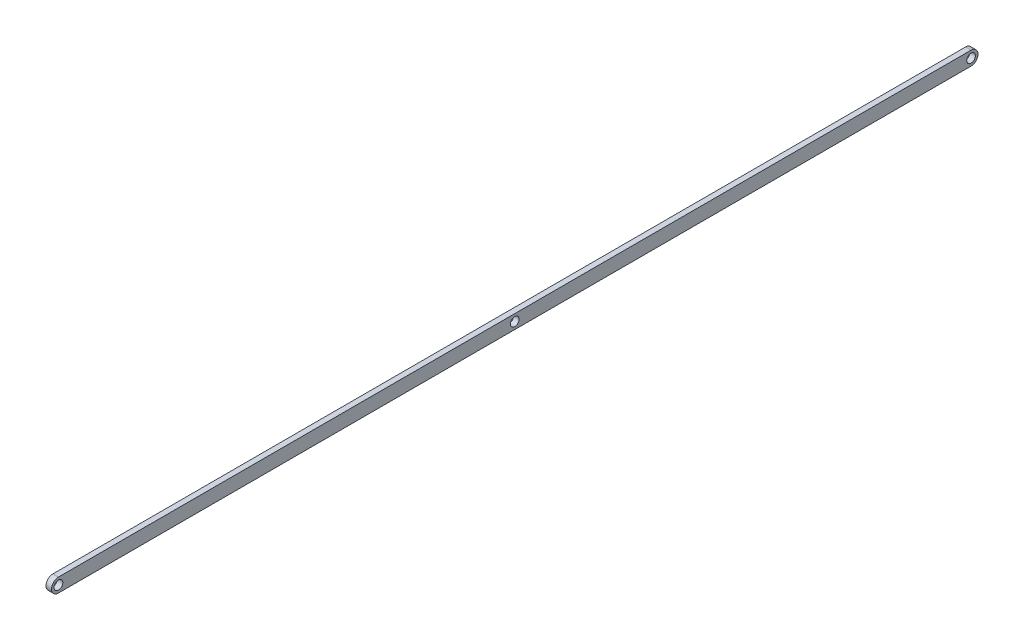
from build123d import *

# Parameters (mm, degrees)
BOSS_EXTRUDE1_DEPTH   = 5.08
F_8_0MM_DOWEL_HOLE1_D = 8


with BuildPart() as part:
    # Sketch1 → Boss-Extrude1 (new body)
    with BuildSketch(Plane(origin=(0, 0, 0), x_dir=(0, 0, -1), z_dir=(1, 0, 0))):
        with BuildLine():
            Line((0, 6.35), (838.2, 6.35))
            ThreePointArc((838.2, 6.35), (844.55, 0), (838.2, -6.35))
            Line((838.2, -6.35), (0, -6.35))
            ThreePointArc((0, -6.35), (-6.35, 0), (0, 6.35))
        make_face()
    extrude(amount=BOSS_EXTRUDE1_DEPTH)

    # Ø8.0mm Dowel Hole1 (through all)
    with Locations(Plane(origin=(5.08, 0, 0), x_dir=(0, 0, -1), z_dir=(1, 0, 0))):
        with Locations((0, 0), (838.2, 0), (419.1, 0)):
            Hole(F_8_0MM_DOWEL_HOLE1_D / 2)


solid = part.part
